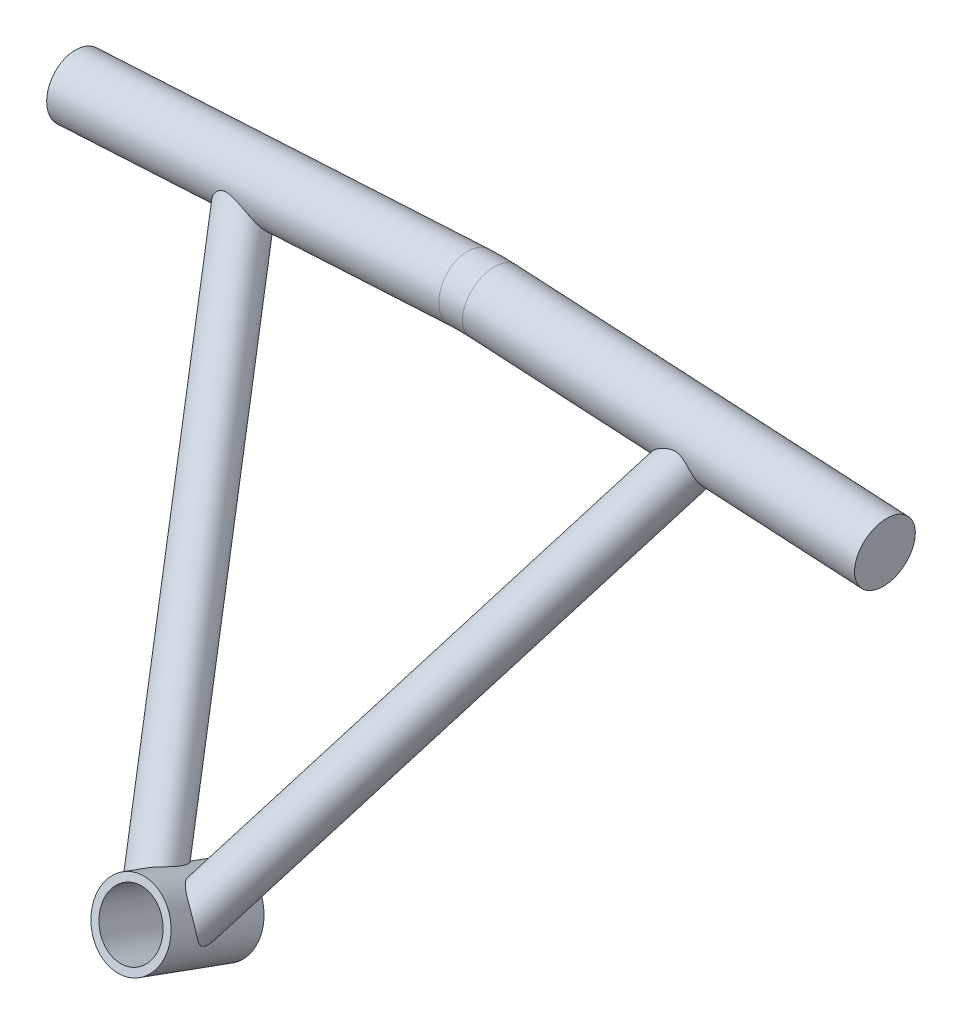
from build123d import *

# Parameters (mm, degrees)
SKETCH1_R           = 15.875
BOSS_EXTRUDE1_DEPTH = 20.701
SWEEP1_PROFILE_R    = 9.525
SWEEP2_PROFILE_R    = 9.525
CUT_EXTRUDE1_REACH  = 233.612
SKETCH2_R           = 12.7
SKETCH36_R          = 7.9375
CUT_EXTRUDE2_DEPTH  = 127
SKETCH37_R          = 7.9375
CUT_EXTRUDE3_DEPTH  = 127
SWEEP3_PROFILE_R    = 12.7


with BuildPart() as part:
    # Sketch1 → Boss-Extrude1 (new, symmetric)
    with BuildSketch(Plane(origin=(0, 0, 0), x_dir=(1, 0, 0), z_dir=(0, 0.34202014332566943, 0.9396926207859081))):
        with Locations(Location((0, 0, 0), (0, 0, 270))):
            Circle(SKETCH1_R)
    extrude(amount=BOSS_EXTRUDE1_DEPTH, both=True)

    # Sweep1: sweep along a path in Sketch4
    with BuildLine(Plane(origin=(0, 3.126764616, 3.726332964), x_dir=(1, 0, 0), z_dir=(0, 0.6427876096865406, 0.7660444431189771))) as sweep1_path:
        Line((-5.08, -4.081701322), (-96.768607765, 201.854283468))
    # Sweep1 profile (on start of the path) → Sweep1 (sweep)
    with BuildSketch(Plane(origin=(-5.08, 0, 6.35), x_dir=(0, 0.6427876096865406, 0.7660444431189771), z_dir=(-0.4067366430758009, 0.6998164213636971, -0.5872157010580841))):
        Circle(SWEEP1_PROFILE_R)
    sweep(path=sweep1_path.line)

    # Sweep2: sweep along a path in Sketch15
    with BuildLine(Plane(origin=(0, 3.126764616, 3.726332964), x_dir=(1, 0, 0), z_dir=(0, 0.6427876096865406, 0.7660444431189771))) as sweep2_path:
        Line((5.08, -4.081701322), (96.768607765, 201.854283468))
    # Sweep2 profile (on start of the path) → Sweep2 (sweep)
    with BuildSketch(Plane(origin=(5.08, 0, 6.35), x_dir=(0, 0.6427876096865406, 0.766044443118977), z_dir=(0.40673664307580104, 0.6998164213636969, -0.587215701058084))):
        Circle(SWEEP2_PROFILE_R)
    sweep(path=sweep2_path.line)

    # Sketch2 → Cut-Extrude1 (cut, up to next)
    with BuildSketch(Plane(origin=(0, -7.080158987, -19.452576943), x_dir=(-1, 0, 0), z_dir=(0, -0.34202014332566943, -0.9396926207859081)), mode=Mode.PRIVATE) as cut_extrude1_sk1:
        with Locations(Location((0, 0, 0), (0, 0, 90))):
            Circle(SKETCH2_R)
    cut_extrude1_tool1 = extrude(cut_extrude1_sk1.sketch, amount=-CUT_EXTRUDE1_REACH, mode=Mode.PRIVATE) & part.part
    add(cut_extrude1_tool1.solids().sort_by_distance((0, -7.080159, -19.452577))[0], mode=Mode.SUBTRACT)

    # Sketch36 → Cut-Extrude2 (cut)
    with BuildSketch(Plane(origin=(-91.012368417, 156.592603715, -131.396796022), x_dir=(0.9135454576426006, 0.31157834524108413, -0.2614452745746218), z_dir=(-0.40673664307580104, 0.699816421363697, -0.5872157010580841))):
        with Locations(Location((-6.300988418, -4.864382214, 0), (0, 0, 270))):
            Circle(SKETCH36_R)
    extrude(amount=-CUT_EXTRUDE2_DEPTH, mode=Mode.SUBTRACT)

    # Sketch37 → Cut-Extrude3 (cut)
    with BuildSketch(Plane(origin=(91.012368417, 156.592603715, -131.396796022), x_dir=(0.9135454576426006, -0.3115783452410842, 0.2614452745746218), z_dir=(0.40673664307580104, 0.6998164213636969, -0.587215701058084))):
        with Locations(Location((6.300988418, -4.864382214, 0), (0, 0, 270))):
            Circle(SKETCH37_R)
    extrude(amount=-CUT_EXTRUDE3_DEPTH, mode=Mode.SUBTRACT)

    # Sweep3: sweep along a path in Sketch40
    with BuildLine(Plane(origin=(-106.934, 0, -127), x_dir=(1, 0, 0), z_dir=(0, 0, 1))) as sweep3_path:
        Line((-62.089448271, 153.292042412), (101.994706052, 162.422680082))
        ThreePointArc((101.994706052, 162.422680082), (106.934, 162.56), (111.873293948, 162.422680082))
        Line((111.873293948, 162.422680082), (275.957448271, 153.292042412))
    # Sweep3 profile (on start of the path) → Sweep3 (sweep)
    with BuildSketch(Plane(origin=(-169.023448271, 153.292042412, -127), x_dir=(-0.055560111902353555, 0.9984553440016224, 0), z_dir=(0.9984553440016224, 0.055560111902353555, 0))):
        Circle(SWEEP3_PROFILE_R)
    sweep(path=sweep3_path.line)


solid = part.part
